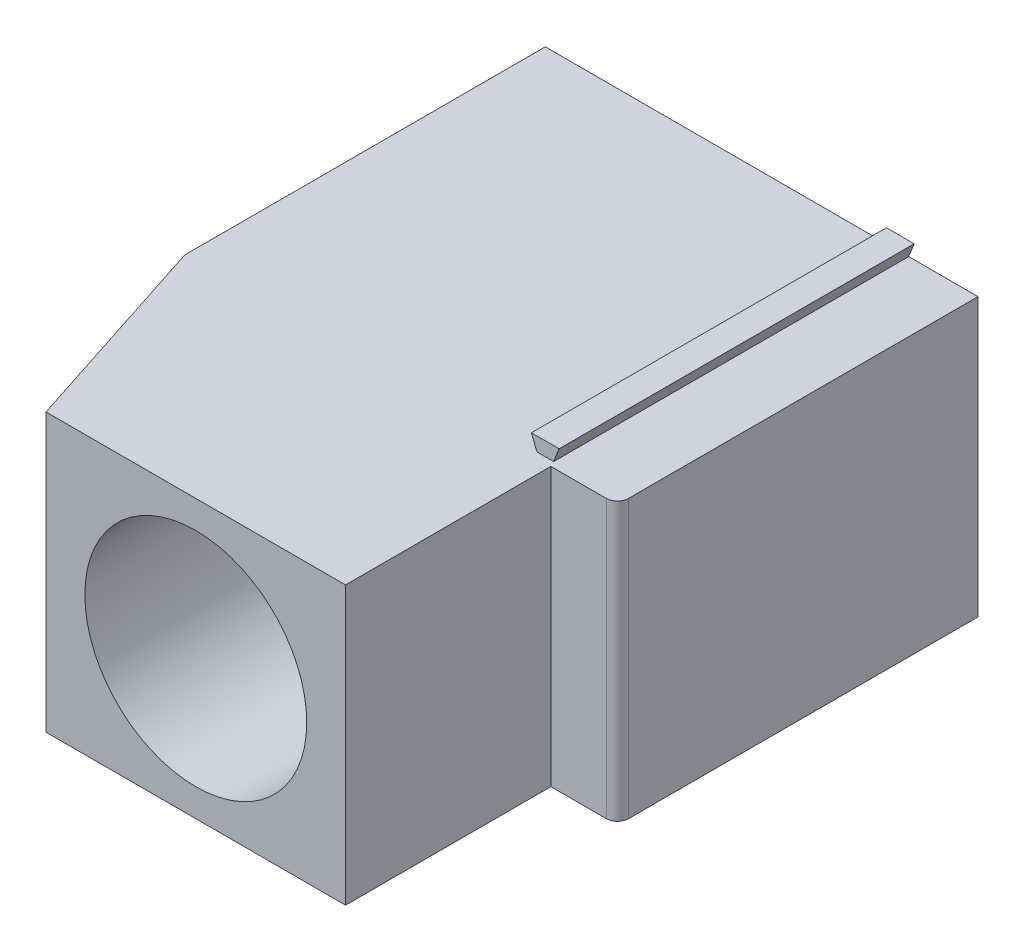
from build123d import *

# Parameters (mm, degrees)
SKETCH_1_W                = 7.8
SKETCH_1_H                = 10.2
EXTRUDE_1_DEPTH           = 4.5
CUT_EXTRUDE_1_DEPTH       = 4
SKETCH_3_W                = 4.5
SKETCH_3_H                = 4
CUT_EXTRUDE_2_DEPTH       = 4.3
SKETCH_4_W                = 7.8
SKETCH_4_H                = 10.2
EXTRUDE_2_DEPTH           = 0.5
SKETCH_5_W                = 1.2
SKETCH_5_H                = 3.7
CUT_EXTRUDE_3_DEPTH       = 14.779695207
CUT_EXTRUDE_4_REACH       = 15.78
SKETCH_7_W                = 0.3
SKETCH_7_H                = 6.4
EXTRUDE_3_DEPTH           = 0.25
DRAFT_1_ANGLE             = -21.801409486
HOLE_WIZARD_4_0_4_1_D     = 4
HOLE_WIZARD_4_0_4_1_DEPTH = 5.7
CHAMFER_1_SIZE            = 1.2
CHAMFER_1_SIZE2           = 3.7
FILLET_1_R                = 0.2


with BuildPart() as part:
    # Эскиз1 → Бобышка-Вытянуть1 (new body)
    with BuildSketch(Plane(origin=(0, 5, 0), x_dir=(1, 0, 0), z_dir=(0, 1, 0))):
        with Locations((-3.9, -5.1)):
            Rectangle(SKETCH_1_W, SKETCH_1_H)
    extrude(amount=-EXTRUDE_1_DEPTH)

    # Эскиз2 → Вырез-Вытянуть1 (cut)
    with BuildSketch(Plane.XZ.offset(-0.5)):
        Polygon((-6.8, 0.8), (-6.8, 5.3), (-7.8, 6.3), (-7.8, 0.8), align=None)
    extrude(amount=-CUT_EXTRUDE_1_DEPTH, mode=Mode.SUBTRACT)

    # Эскиз3 → Вырез-Вытянуть2 (cut)
    with BuildSketch(Plane.ZY.offset(6.8)):
        with Locations((3.05, 2.5)):
            Rectangle(SKETCH_3_W, SKETCH_3_H)
    extrude(amount=-CUT_EXTRUDE_2_DEPTH, mode=Mode.SUBTRACT)

    # Эскиз4 → Бобышка-Вытянуть2 (add)
    with BuildSketch(Plane.XZ.offset(-0.5)):
        with Locations((-3.9, 5.1)):
            Rectangle(SKETCH_4_W, SKETCH_4_H)
    extrude(amount=EXTRUDE_2_DEPTH)

    # Эскиз5 → Вырез-Вытянуть3 (cut, through all)
    with BuildSketch(Plane(origin=(0, 5, 0), x_dir=(-1, 0, 0), z_dir=(0, 1, 0))):
        with Locations((0.6, 8.35)):
            Rectangle(SKETCH_5_W, SKETCH_5_H)
    extrude(amount=-CUT_EXTRUDE_3_DEPTH, mode=Mode.SUBTRACT)

    # Эскиз6 → Вырез-Вытянуть4 (cut, up to next)
    with BuildSketch(Plane(origin=(0, 0, 0), x_dir=(-1, 0, 0), z_dir=(0, 0, -1)), mode=Mode.PRIVATE) as cut_extrude_4_sk1:
        with BuildLine():
            Line((7.8, 2.1), (7.8, 2.9))
            Line((7.8, 2.9), (3.71823341, 2.9))
            ThreePointArc((3.71823341, 2.9), (3.31823341, 2.5), (3.71823341, 2.1))
            Line((3.71823341, 2.1), (7.8, 2.1))
        make_face()
    cut_extrude_4_tool1 = extrude(cut_extrude_4_sk1.sketch, amount=-CUT_EXTRUDE_4_REACH, mode=Mode.PRIVATE) & part.part
    add(cut_extrude_4_tool1.solids().sort_by_distance((-5.60113, 2.5, 0))[0], mode=Mode.SUBTRACT)

    # Эскиз7 → Бобышка-Вытянуть3 (add)
    with BuildSketch(Plane(origin=(0, 5, 0), x_dir=(-1, 0, 0), z_dir=(0, 1, 0))):
        with Locations((1.4, 3.2)):
            Rectangle(SKETCH_7_W, SKETCH_7_H)
    extrude(amount=EXTRUDE_3_DEPTH)

    # Уклон1
    draft_1_faces = [part.faces().sort_by_distance(p)[0] for p in [
        (-1.55, 5.125, 3.2),
        (-1.25, 5.125, 3.2),
    ]]
    draft(draft_1_faces, Plane.ZX.offset(5), DRAFT_1_ANGLE)

    # Диаметр отверстия Ø4.0 (4)1
    with Locations(Plane.XY.offset(10.2)):
        with Locations((-3.9, 2.5)):
            Hole(HOLE_WIZARD_4_0_4_1_D / 2, depth=HOLE_WIZARD_4_0_4_1_DEPTH)

    # Фаска1
    chamfer_1_edges = [part.edges().sort_by_distance(p)[0] for p in [
        (-7.8, 2.5, 10.2),
    ]]
    chamfer_1_side = [part.faces().sort_by_distance(p)[0] for p in [
        (-4.5, 4.917199034, 10.2),
    ]]
    chamfer(chamfer_1_edges, length=CHAMFER_1_SIZE, length2=CHAMFER_1_SIZE2, reference=chamfer_1_side[0])

    # Скругление1
    fillet_1_edges = [part.edges().sort_by_distance(p)[0] for p in [
        (0, 2.5, 6.5),
    ]]
    fillet(fillet_1_edges, radius=FILLET_1_R)


solid = part.part
